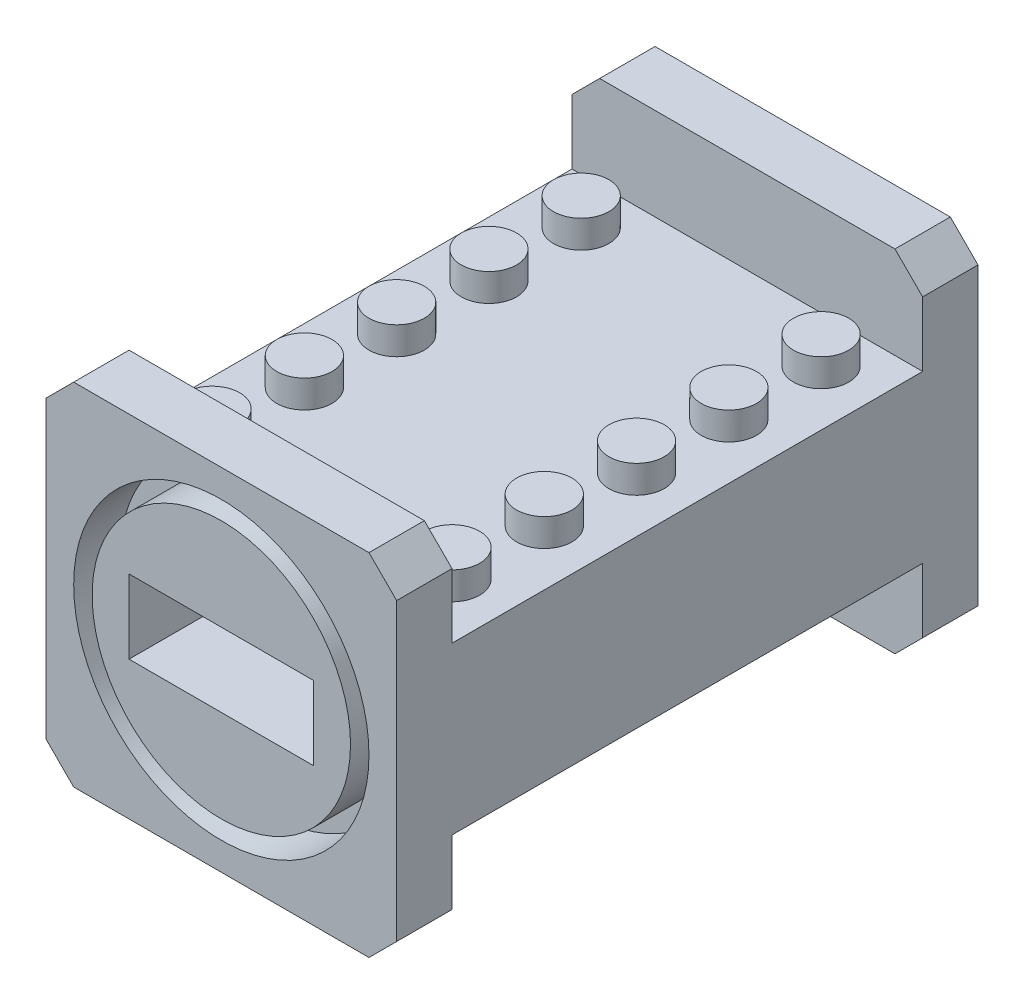
from build123d import *

# Parameters (mm, degrees)
SKETCH2_W           = 38
SKETCH2_H           = 38
BOSS_EXTRUDE1_DEPTH = 63
SKETCH3_W           = 51
SKETCH3_H           = 10
CUT_EXTRUDE1_DEPTH  = 83.807004535
SKETCH4_W           = 20
SKETCH4_H           = 8
CUT_EXTRUDE2_DEPTH  = 83.807004535
SKETCH5_R           = 16
SKETCH5_R_2         = 14
CUT_EXTRUDE3_DEPTH  = 5
SKETCH6_R           = 3
BOSS_EXTRUDE2_DEPTH = 3
BOSS_EXTRUDE3_START = -21
SKETCH6_2_R         = 3
BOSS_EXTRUDE3_DEPTH = 3
CHAMFER1_SIZE       = 3


with BuildPart() as part:
    # Sketch2 → Boss-Extrude1 (new body)
    with BuildSketch(Plane.XY):
        with Locations((19, 19)):
            Rectangle(SKETCH2_W, SKETCH2_H)
    extrude(amount=-BOSS_EXTRUDE1_DEPTH)

    # Sketch3 → Cut-Extrude1 (cut, through all)
    with BuildSketch(Plane(origin=(38, 0, 0), x_dir=(0, 0, -1), z_dir=(1, 0, 0))):
        with Locations((31.5, 33)):
            Rectangle(SKETCH3_W, SKETCH3_H)
        with Locations((31.5, 5)):
            Rectangle(SKETCH3_W, SKETCH3_H)
    extrude(amount=-CUT_EXTRUDE1_DEPTH, mode=Mode.SUBTRACT)

    # Sketch4 → Cut-Extrude2 (cut, through all)
    with BuildSketch(Plane.XY):
        with Locations((19, 19)):
            Rectangle(SKETCH4_W, SKETCH4_H)
    extrude(amount=-CUT_EXTRUDE2_DEPTH, mode=Mode.SUBTRACT)

    # Sketch5 → Cut-Extrude3 (cut)
    with BuildSketch(Plane.XY):
        with Locations((19, 19)):
            Circle(SKETCH5_R)
        with Locations((19, 19)):
            Circle(SKETCH5_R_2, mode=Mode.SUBTRACT)
    extrude(amount=-CUT_EXTRUDE3_DEPTH, mode=Mode.SUBTRACT)

    # Sketch6 → Boss-Extrude2 (add)
    with BuildSketch(Plane(origin=(0, 28, 0), x_dir=(1, 0, 0), z_dir=(0, 1, 0))):
        with Locations(Location((32, 12, 0), (0, 0, 90))):
            Circle(SKETCH6_R)
        with Locations(Location((32, 22, 0), (0, 0, 90))):
            Circle(SKETCH6_R)
        with Locations(Location((32, 32, 0), (0, 0, 90))):
            Circle(SKETCH6_R)
        with Locations(Location((32, 42, 0), (0, 0, 90))):
            Circle(SKETCH6_R)
        with Locations(Location((32, 52, 0), (0, 0, 90))):
            Circle(SKETCH6_R)
        with Locations(Location((6, 12, 0), (0, 0, 90))):
            Circle(SKETCH6_R)
        with Locations(Location((6, 22, 0), (0, 0, 90))):
            Circle(SKETCH6_R)
        with Locations(Location((6, 32, 0), (0, 0, 90))):
            Circle(SKETCH6_R)
        with Locations(Location((6, 42, 0), (0, 0, 90))):
            Circle(SKETCH6_R)
        with Locations(Location((6, 52, 0), (0, 0, 90))):
            Circle(SKETCH6_R)
    extrude(amount=BOSS_EXTRUDE2_DEPTH)

    # Sketch6<2> → Boss-Extrude3 (add)
    with BuildSketch(Plane(origin=(0, 28, 0), x_dir=(1, 0, 0), z_dir=(0, 1, 0)).offset(BOSS_EXTRUDE3_START)):
        with Locations(Location((32, 12, 0), (0, 0, 90))):
            Circle(SKETCH6_2_R)
        with Locations(Location((32, 22, 0), (0, 0, 90))):
            Circle(SKETCH6_2_R)
        with Locations(Location((32, 32, 0), (0, 0, 90))):
            Circle(SKETCH6_2_R)
        with Locations(Location((32, 42, 0), (0, 0, 90))):
            Circle(SKETCH6_2_R)
        with Locations(Location((32, 52, 0), (0, 0, 90))):
            Circle(SKETCH6_2_R)
        with Locations(Location((6, 12, 0), (0, 0, 90))):
            Circle(SKETCH6_2_R)
        with Locations(Location((6, 22, 0), (0, 0, 90))):
            Circle(SKETCH6_2_R)
        with Locations(Location((6, 32, 0), (0, 0, 90))):
            Circle(SKETCH6_2_R)
        with Locations(Location((6, 42, 0), (0, 0, 90))):
            Circle(SKETCH6_2_R)
        with Locations(Location((6, 52, 0), (0, 0, 90))):
            Circle(SKETCH6_2_R)
    extrude(amount=BOSS_EXTRUDE3_DEPTH)

    # Chamfer1
    chamfer1_edges = [part.edges().sort_by_distance(p)[0] for p in [
        (0, 0, -3),
        (38, 0, -3),
        (38, 38, -3),
        (0, 38, -3),
        (0, 38, -60),
        (38, 38, -60),
        (38, 0, -60),
        (0, 0, -60),
    ]]
    chamfer(chamfer1_edges, length=CHAMFER1_SIZE)


solid = part.part
